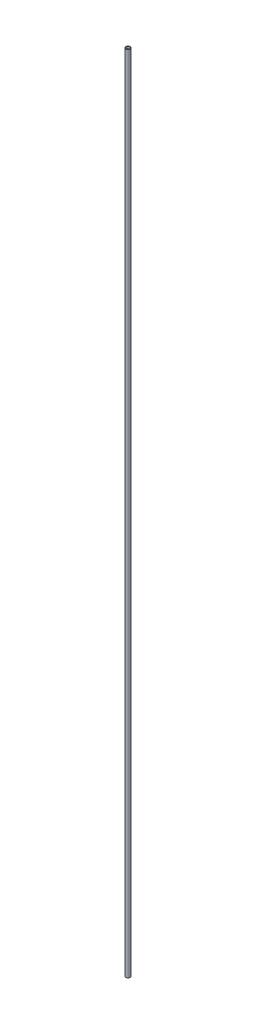
from build123d import *

# Parameters (mm, degrees)
SKETCH1_R           = 4.7625
SKETCH1_R_2         = 3.7465
BOSS_EXTRUDE1_DEPTH = 889


with BuildPart() as part:
    # Sketch1 → Boss-Extrude1 (new, symmetric)
    with BuildSketch(Plane(origin=(0, 0, 0), x_dir=(1, 0, 0), z_dir=(0, 1, 0))):
        with Locations(Location((0, 0, 0), (0, 0, 270))):
            Circle(SKETCH1_R)
        with Locations(Location((0, 0, 0), (0, 0, 270))):
            Circle(SKETCH1_R_2, mode=Mode.SUBTRACT)
    extrude(amount=BOSS_EXTRUDE1_DEPTH, both=True)


solid = part.part
